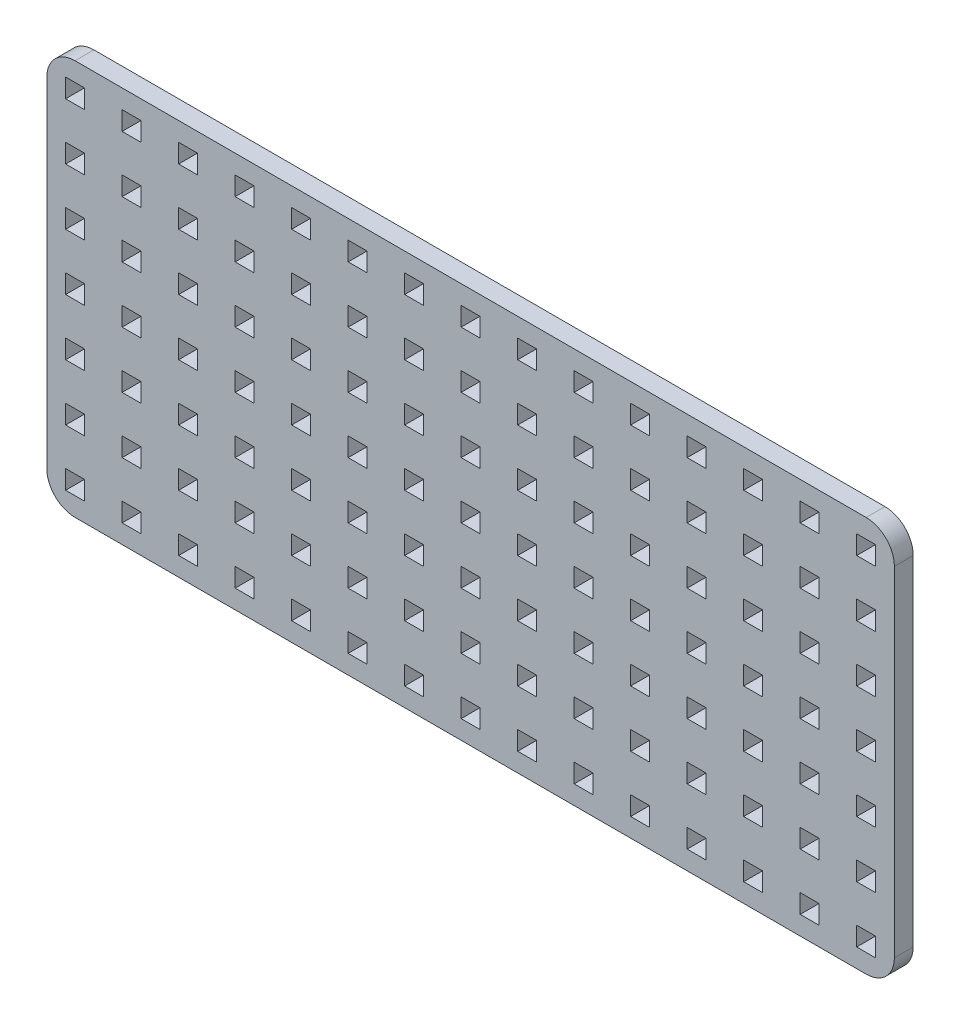
from build123d import *

# Parameters (mm, degrees)
MODEL_W                 = 3
MODEL_H                 = 3
SALIENTE_EXTRUIR1_DEPTH = 3


with BuildPart() as part:
    # Model → Saliente-Extruir1 (new body)
    with BuildSketch(Plane.XY):
        with BuildLine():
            Line((143.991247384, 235.704056046), (143.991247384, 289.701328199))
            ThreePointArc((143.991247384, 289.701328199), (142.673227899, 292.883308715), (139.491247384, 294.201328199))
            Line((139.491247384, 294.201328199), (13.491247384, 294.201328199))
            ThreePointArc((13.491247384, 294.201328199), (10.309266869, 292.883308715), (8.991247384, 289.701328199))
            Line((8.991247384, 289.701328199), (8.991247384, 235.704056046))
            ThreePointArc((8.991247384, 235.704056046), (10.309266869, 232.52207553), (13.491247384, 231.204056046))
            Line((13.491247384, 231.204056046), (139.491247384, 231.204056046))
            ThreePointArc((139.491247384, 231.204056046), (142.673227899, 232.52207553), (143.991247384, 235.704056046))
        make_face()
        with Locations((13.491247384, 289.701328199)):
            Rectangle(MODEL_W, MODEL_H, mode=Mode.SUBTRACT)
        with Locations((22.491247384, 289.701328199)):
            Rectangle(MODEL_W, MODEL_H, mode=Mode.SUBTRACT)
        with Locations((31.491247384, 289.701328199)):
            Rectangle(MODEL_W, MODEL_H, mode=Mode.SUBTRACT)
        with Locations((40.491247384, 289.701328199)):
            Rectangle(MODEL_W, MODEL_H, mode=Mode.SUBTRACT)
        with Locations((49.491247384, 289.701328199)):
            Rectangle(MODEL_W, MODEL_H, mode=Mode.SUBTRACT)
        with Locations((58.491247384, 289.701328199)):
            Rectangle(MODEL_W, MODEL_H, mode=Mode.SUBTRACT)
        with Locations((67.491247384, 289.701328199)):
            Rectangle(MODEL_W, MODEL_H, mode=Mode.SUBTRACT)
        with Locations((76.491247384, 289.701328199)):
            Rectangle(MODEL_W, MODEL_H, mode=Mode.SUBTRACT)
        with Locations((85.491247384, 289.701328199)):
            Rectangle(MODEL_W, MODEL_H, mode=Mode.SUBTRACT)
        with Locations((94.491247384, 289.701328199)):
            Rectangle(MODEL_W, MODEL_H, mode=Mode.SUBTRACT)
        with Locations((103.491247384, 289.701328199)):
            Rectangle(MODEL_W, MODEL_H, mode=Mode.SUBTRACT)
        with Locations((112.491247384, 289.701328199)):
            Rectangle(MODEL_W, MODEL_H, mode=Mode.SUBTRACT)
        with Locations((121.491247384, 289.701328199)):
            Rectangle(MODEL_W, MODEL_H, mode=Mode.SUBTRACT)
        with Locations((130.491247384, 289.701328199)):
            Rectangle(MODEL_W, MODEL_H, mode=Mode.SUBTRACT)
        with Locations((139.491247384, 289.701328199)):
            Rectangle(MODEL_W, MODEL_H, mode=Mode.SUBTRACT)
        with Locations((13.491247384, 280.701328199)):
            Rectangle(MODEL_W, MODEL_H, mode=Mode.SUBTRACT)
        with Locations((22.491247384, 280.701328199)):
            Rectangle(MODEL_W, MODEL_H, mode=Mode.SUBTRACT)
        with Locations((31.491247384, 280.701328199)):
            Rectangle(MODEL_W, MODEL_H, mode=Mode.SUBTRACT)
        with Locations((40.491247384, 280.701328199)):
            Rectangle(MODEL_W, MODEL_H, mode=Mode.SUBTRACT)
        with Locations((49.491247384, 280.701328199)):
            Rectangle(MODEL_W, MODEL_H, mode=Mode.SUBTRACT)
        with Locations((58.491247384, 280.701328199)):
            Rectangle(MODEL_W, MODEL_H, mode=Mode.SUBTRACT)
        with Locations((67.491247384, 280.701328199)):
            Rectangle(MODEL_W, MODEL_H, mode=Mode.SUBTRACT)
        with Locations((76.491247384, 280.701328199)):
            Rectangle(MODEL_W, MODEL_H, mode=Mode.SUBTRACT)
        with Locations((85.491247384, 280.701328199)):
            Rectangle(MODEL_W, MODEL_H, mode=Mode.SUBTRACT)
        with Locations((94.491247384, 280.701328199)):
            Rectangle(MODEL_W, MODEL_H, mode=Mode.SUBTRACT)
        with Locations((103.491247384, 280.701328199)):
            Rectangle(MODEL_W, MODEL_H, mode=Mode.SUBTRACT)
        with Locations((112.491247384, 280.701328199)):
            Rectangle(MODEL_W, MODEL_H, mode=Mode.SUBTRACT)
        with Locations((121.491247384, 280.701328199)):
            Rectangle(MODEL_W, MODEL_H, mode=Mode.SUBTRACT)
        with Locations((130.491247384, 280.701328199)):
            Rectangle(MODEL_W, MODEL_H, mode=Mode.SUBTRACT)
        with Locations((139.491247384, 280.701328199)):
            Rectangle(MODEL_W, MODEL_H, mode=Mode.SUBTRACT)
        with Locations((13.491247384, 271.701328199)):
            Rectangle(MODEL_W, MODEL_H, mode=Mode.SUBTRACT)
        with Locations((22.491247384, 271.701328199)):
            Rectangle(MODEL_W, MODEL_H, mode=Mode.SUBTRACT)
        with Locations((31.491247384, 271.701328199)):
            Rectangle(MODEL_W, MODEL_H, mode=Mode.SUBTRACT)
        with Locations((40.491247384, 271.701328199)):
            Rectangle(MODEL_W, MODEL_H, mode=Mode.SUBTRACT)
        with Locations((49.491247384, 271.701328199)):
            Rectangle(MODEL_W, MODEL_H, mode=Mode.SUBTRACT)
        with Locations((58.491247384, 271.701328199)):
            Rectangle(MODEL_W, MODEL_H, mode=Mode.SUBTRACT)
        with Locations((67.491247384, 271.701328199)):
            Rectangle(MODEL_W, MODEL_H, mode=Mode.SUBTRACT)
        with Locations((76.491247384, 271.701328199)):
            Rectangle(MODEL_W, MODEL_H, mode=Mode.SUBTRACT)
        with Locations((85.491247384, 271.701328199)):
            Rectangle(MODEL_W, MODEL_H, mode=Mode.SUBTRACT)
        with Locations((94.491247384, 271.701328199)):
            Rectangle(MODEL_W, MODEL_H, mode=Mode.SUBTRACT)
        with Locations((103.491247384, 271.701328199)):
            Rectangle(MODEL_W, MODEL_H, mode=Mode.SUBTRACT)
        with Locations((112.491247384, 271.701328199)):
            Rectangle(MODEL_W, MODEL_H, mode=Mode.SUBTRACT)
        with Locations((121.491247384, 271.701328199)):
            Rectangle(MODEL_W, MODEL_H, mode=Mode.SUBTRACT)
        with Locations((130.491247384, 271.701328199)):
            Rectangle(MODEL_W, MODEL_H, mode=Mode.SUBTRACT)
        with Locations((139.491247384, 271.701328199)):
            Rectangle(MODEL_W, MODEL_H, mode=Mode.SUBTRACT)
        with Locations((13.491247384, 262.701328199)):
            Rectangle(MODEL_W, MODEL_H, mode=Mode.SUBTRACT)
        with Locations((22.491247384, 262.701328199)):
            Rectangle(MODEL_W, MODEL_H, mode=Mode.SUBTRACT)
        with Locations((31.491247384, 262.701328199)):
            Rectangle(MODEL_W, MODEL_H, mode=Mode.SUBTRACT)
        with Locations((40.491247384, 262.701328199)):
            Rectangle(MODEL_W, MODEL_H, mode=Mode.SUBTRACT)
        with Locations((49.491247384, 262.701328199)):
            Rectangle(MODEL_W, MODEL_H, mode=Mode.SUBTRACT)
        with Locations((58.491247384, 262.701328199)):
            Rectangle(MODEL_W, MODEL_H, mode=Mode.SUBTRACT)
        with Locations((67.491247384, 262.701328199)):
            Rectangle(MODEL_W, MODEL_H, mode=Mode.SUBTRACT)
        with Locations((76.491247384, 262.701328199)):
            Rectangle(MODEL_W, MODEL_H, mode=Mode.SUBTRACT)
        with Locations((85.491247384, 262.701328199)):
            Rectangle(MODEL_W, MODEL_H, mode=Mode.SUBTRACT)
        with Locations((94.491247384, 262.701328199)):
            Rectangle(MODEL_W, MODEL_H, mode=Mode.SUBTRACT)
        with Locations((103.491247384, 262.701328199)):
            Rectangle(MODEL_W, MODEL_H, mode=Mode.SUBTRACT)
        with Locations((112.491247384, 262.701328199)):
            Rectangle(MODEL_W, MODEL_H, mode=Mode.SUBTRACT)
        with Locations((121.491247384, 262.701328199)):
            Rectangle(MODEL_W, MODEL_H, mode=Mode.SUBTRACT)
        with Locations((130.491247384, 262.701328199)):
            Rectangle(MODEL_W, MODEL_H, mode=Mode.SUBTRACT)
        with Locations((139.491247384, 262.701328199)):
            Rectangle(MODEL_W, MODEL_H, mode=Mode.SUBTRACT)
        with Locations((13.491247384, 253.701328199)):
            Rectangle(MODEL_W, MODEL_H, mode=Mode.SUBTRACT)
        with Locations((22.491247384, 253.701328199)):
            Rectangle(MODEL_W, MODEL_H, mode=Mode.SUBTRACT)
        with Locations((31.491247384, 253.701328199)):
            Rectangle(MODEL_W, MODEL_H, mode=Mode.SUBTRACT)
        with Locations((40.491247384, 253.701328199)):
            Rectangle(MODEL_W, MODEL_H, mode=Mode.SUBTRACT)
        with Locations((49.491247384, 253.701328199)):
            Rectangle(MODEL_W, MODEL_H, mode=Mode.SUBTRACT)
        with Locations((58.491247384, 253.701328199)):
            Rectangle(MODEL_W, MODEL_H, mode=Mode.SUBTRACT)
        with Locations((67.491247384, 253.701328199)):
            Rectangle(MODEL_W, MODEL_H, mode=Mode.SUBTRACT)
        with Locations((76.491247384, 253.701328199)):
            Rectangle(MODEL_W, MODEL_H, mode=Mode.SUBTRACT)
        with Locations((85.491247384, 253.701328199)):
            Rectangle(MODEL_W, MODEL_H, mode=Mode.SUBTRACT)
        with Locations((94.491247384, 253.701328199)):
            Rectangle(MODEL_W, MODEL_H, mode=Mode.SUBTRACT)
        with Locations((103.491247384, 253.701328199)):
            Rectangle(MODEL_W, MODEL_H, mode=Mode.SUBTRACT)
        with Locations((112.491247384, 253.701328199)):
            Rectangle(MODEL_W, MODEL_H, mode=Mode.SUBTRACT)
        with Locations((121.491247384, 253.701328199)):
            Rectangle(MODEL_W, MODEL_H, mode=Mode.SUBTRACT)
        with Locations((130.491247384, 253.701328199)):
            Rectangle(MODEL_W, MODEL_H, mode=Mode.SUBTRACT)
        with Locations((139.491247384, 253.701328199)):
            Rectangle(MODEL_W, MODEL_H, mode=Mode.SUBTRACT)
        with Locations((13.491247384, 244.701328199)):
            Rectangle(MODEL_W, MODEL_H, mode=Mode.SUBTRACT)
        with Locations((22.491247384, 244.701328199)):
            Rectangle(MODEL_W, MODEL_H, mode=Mode.SUBTRACT)
        with Locations((31.491247384, 244.701328199)):
            Rectangle(MODEL_W, MODEL_H, mode=Mode.SUBTRACT)
        with Locations((40.491247384, 244.701328199)):
            Rectangle(MODEL_W, MODEL_H, mode=Mode.SUBTRACT)
        with Locations((49.491247384, 244.701328199)):
            Rectangle(MODEL_W, MODEL_H, mode=Mode.SUBTRACT)
        with Locations((58.491247384, 244.701328199)):
            Rectangle(MODEL_W, MODEL_H, mode=Mode.SUBTRACT)
        with Locations((67.491247384, 244.701328199)):
            Rectangle(MODEL_W, MODEL_H, mode=Mode.SUBTRACT)
        with Locations((76.491247384, 244.701328199)):
            Rectangle(MODEL_W, MODEL_H, mode=Mode.SUBTRACT)
        with Locations((85.491247384, 244.701328199)):
            Rectangle(MODEL_W, MODEL_H, mode=Mode.SUBTRACT)
        with Locations((94.491247384, 244.701328199)):
            Rectangle(MODEL_W, MODEL_H, mode=Mode.SUBTRACT)
        with Locations((103.491247384, 244.701328199)):
            Rectangle(MODEL_W, MODEL_H, mode=Mode.SUBTRACT)
        with Locations((112.491247384, 244.701328199)):
            Rectangle(MODEL_W, MODEL_H, mode=Mode.SUBTRACT)
        with Locations((121.491247384, 244.701328199)):
            Rectangle(MODEL_W, MODEL_H, mode=Mode.SUBTRACT)
        with Locations((130.491247384, 244.701328199)):
            Rectangle(MODEL_W, MODEL_H, mode=Mode.SUBTRACT)
        with Locations((139.491247384, 244.701328199)):
            Rectangle(MODEL_W, MODEL_H, mode=Mode.SUBTRACT)
        with Locations((13.491247384, 235.701328199)):
            Rectangle(MODEL_W, MODEL_H, mode=Mode.SUBTRACT)
        with Locations((22.491247384, 235.701328199)):
            Rectangle(MODEL_W, MODEL_H, mode=Mode.SUBTRACT)
        with Locations((31.491247384, 235.701328199)):
            Rectangle(MODEL_W, MODEL_H, mode=Mode.SUBTRACT)
        with Locations((40.491247384, 235.701328199)):
            Rectangle(MODEL_W, MODEL_H, mode=Mode.SUBTRACT)
        with Locations((49.491247384, 235.701328199)):
            Rectangle(MODEL_W, MODEL_H, mode=Mode.SUBTRACT)
        with Locations((58.491247384, 235.701328199)):
            Rectangle(MODEL_W, MODEL_H, mode=Mode.SUBTRACT)
        with Locations((67.491247384, 235.701328199)):
            Rectangle(MODEL_W, MODEL_H, mode=Mode.SUBTRACT)
        with Locations((76.491247384, 235.701328199)):
            Rectangle(MODEL_W, MODEL_H, mode=Mode.SUBTRACT)
        with Locations((85.491247384, 235.701328199)):
            Rectangle(MODEL_W, MODEL_H, mode=Mode.SUBTRACT)
        with Locations((94.491247384, 235.701328199)):
            Rectangle(MODEL_W, MODEL_H, mode=Mode.SUBTRACT)
        with Locations((103.491247384, 235.701328199)):
            Rectangle(MODEL_W, MODEL_H, mode=Mode.SUBTRACT)
        with Locations((112.491247384, 235.701328199)):
            Rectangle(MODEL_W, MODEL_H, mode=Mode.SUBTRACT)
        with Locations((121.491247384, 235.701328199)):
            Rectangle(MODEL_W, MODEL_H, mode=Mode.SUBTRACT)
        with Locations((130.491247384, 235.701328199)):
            Rectangle(MODEL_W, MODEL_H, mode=Mode.SUBTRACT)
        with Locations((139.491247384, 235.701328199)):
            Rectangle(MODEL_W, MODEL_H, mode=Mode.SUBTRACT)
    extrude(amount=SALIENTE_EXTRUIR1_DEPTH)


solid = part.part
